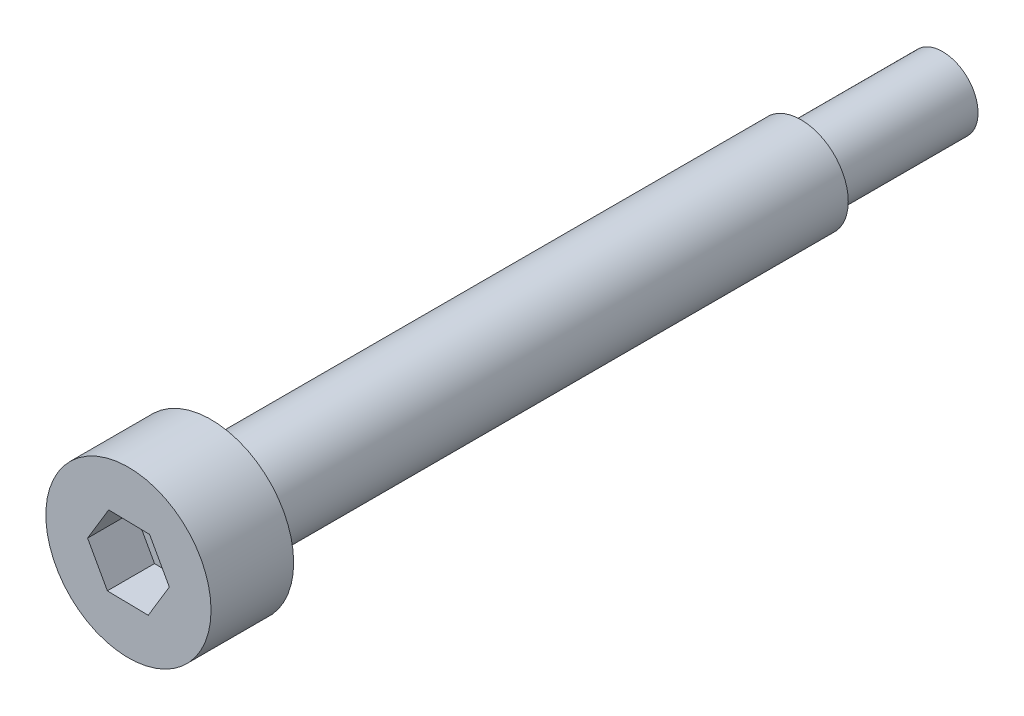
from build123d import *

# Parameters (mm, degrees)
SKETCH_1_R          = 3.5
EXTRUDE_1_DEPTH     = 3.5
CUT_EXTRUDE_1_DEPTH = 2
SKETCH_3_R          = 2
EXTRUDE_2_DEPTH     = 25
SKETCH_4_R          = 1.5
EXTRUDE_3_DEPTH     = 6


with BuildPart() as part:
    # 草图1 → 凸台-拉伸1 (new body)
    with BuildSketch(Plane.XY):
        Circle(SKETCH_1_R)
    extrude(amount=EXTRUDE_1_DEPTH)

    # 草图2 → 切除-拉伸1 (cut)
    with BuildSketch(Plane.XY.offset(3.5)):
        Polygon((0.893639487, 1.483714416), (-0.838114632, 1.515771705), (-1.731754119, 0.03205729), (-0.893639487, -1.483714416), (0.838114632, -1.515771705), (1.731754119, -0.03205729), align=None)
    extrude(amount=-CUT_EXTRUDE_1_DEPTH, mode=Mode.SUBTRACT)

    # 草图3 → 凸台-拉伸2 (add)
    with BuildSketch(Plane(origin=(0, 0, 0), x_dir=(-1, 0, 0), z_dir=(0, 0, -1))):
        with Locations(Location((0, 0, 0), (0, 0, 180))):
            Circle(SKETCH_3_R)
    extrude(amount=EXTRUDE_2_DEPTH)

    # 草图4 → 凸台-拉伸3 (add)
    with BuildSketch(Plane(origin=(0, 0, -25), x_dir=(-1, 0, 0), z_dir=(0, 0, -1))):
        Circle(SKETCH_4_R)
    extrude(amount=EXTRUDE_3_DEPTH)


solid = part.part
